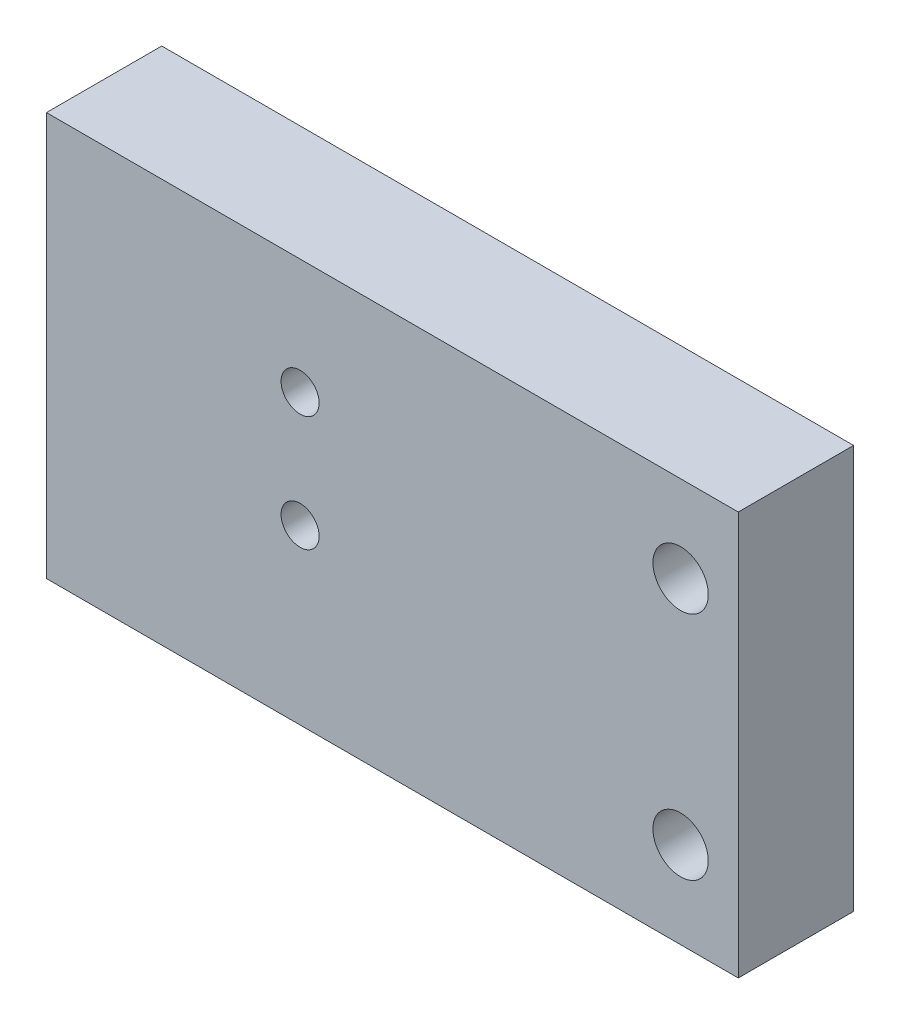
from build123d import *

# Parameters (mm, degrees)
SKETCH_1_W                   = 60
SKETCH_1_H                   = 35
EXTRUDE_1_DEPTH              = 10
HOLE_WIZARD_M4_1_D           = 4.8
HOLE_WIZARD_M4_1_CBORE_D     = 8
HOLE_WIZARD_M4_1_CBORE_DEPTH = 4
HOLE_WIZARD_M4_1_2_D         = 3.3


with BuildPart() as part:
    # 草图1 → 凸台-拉伸1 (new body)
    with BuildSketch(Plane.XY):
        with Locations((30, 17.5)):
            Rectangle(SKETCH_1_W, SKETCH_1_H)
    extrude(amount=EXTRUDE_1_DEPTH)

    # Hole Wizard M4 _1 (through all)
    with Locations(Plane(origin=(0, 0, 0), x_dir=(-1, 0, 0), z_dir=(0, 0, -1))):
        with Locations((-55, 7.5), (-55, 27.5)):
            CounterBoreHole(HOLE_WIZARD_M4_1_D / 2, HOLE_WIZARD_M4_1_CBORE_D / 2, HOLE_WIZARD_M4_1_CBORE_DEPTH)

    # Hole Wizard M4 _1 2 (through all)
    with Locations(Plane(origin=(0, 0, 0), x_dir=(-1, 0, 0), z_dir=(0, 0, -1))):
        with Locations((-22, 25), (-22, 15)):
            Hole(HOLE_WIZARD_M4_1_2_D / 2)


solid = part.part
